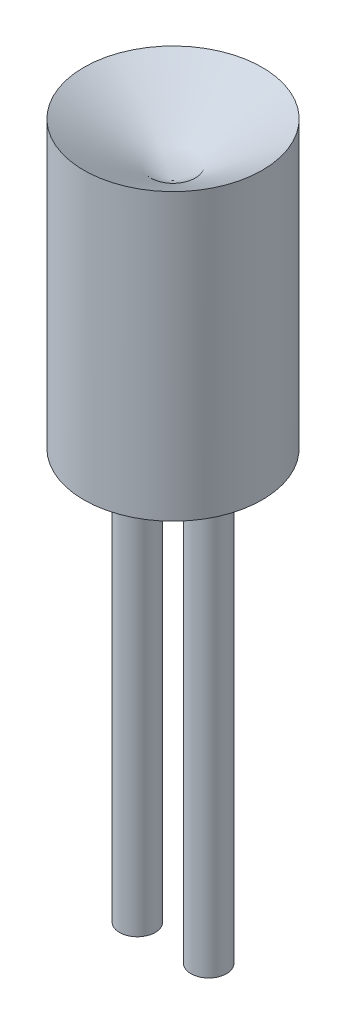
from build123d import *

# Parameters (mm, degrees)
SKETCH1_R           = 2.5
BOSS_EXTRUDE1_DEPTH = 8
SKETCH3_R           = 0.5
BOSS_EXTRUDE2_DEPTH = 12


with BuildPart() as part:
    # Sketch1 → Boss-Extrude1 (new body)
    with BuildSketch(Plane(origin=(0, 0, 0), x_dir=(1, 0, 0), z_dir=(0, 1, 0))):
        with Locations(Location((0, 0, 0), (0, 0, 270))):
            Circle(SKETCH1_R)
    extrude(amount=BOSS_EXTRUDE1_DEPTH)

    # Sketch2 → Cut-Revolve2 (revolve, cut)
    with BuildSketch(Plane.XY):
        Polygon((0, 8), (0, 6.5), (-2.5, 8), align=None)
    revolve(axis=Axis((0, 8, 0), (0, -1, 0)), mode=Mode.SUBTRACT)

    # Sketch3 → Boss-Extrude2 (add)
    with BuildSketch(Plane.XZ):
        with Locations(Location((-1, 0, 0), (0, 0, 90))):
            Circle(SKETCH3_R)
        with Locations(Location((1, 0, 0), (0, 0, 90))):
            Circle(SKETCH3_R)
    extrude(amount=BOSS_EXTRUDE2_DEPTH)


solid = part.part
